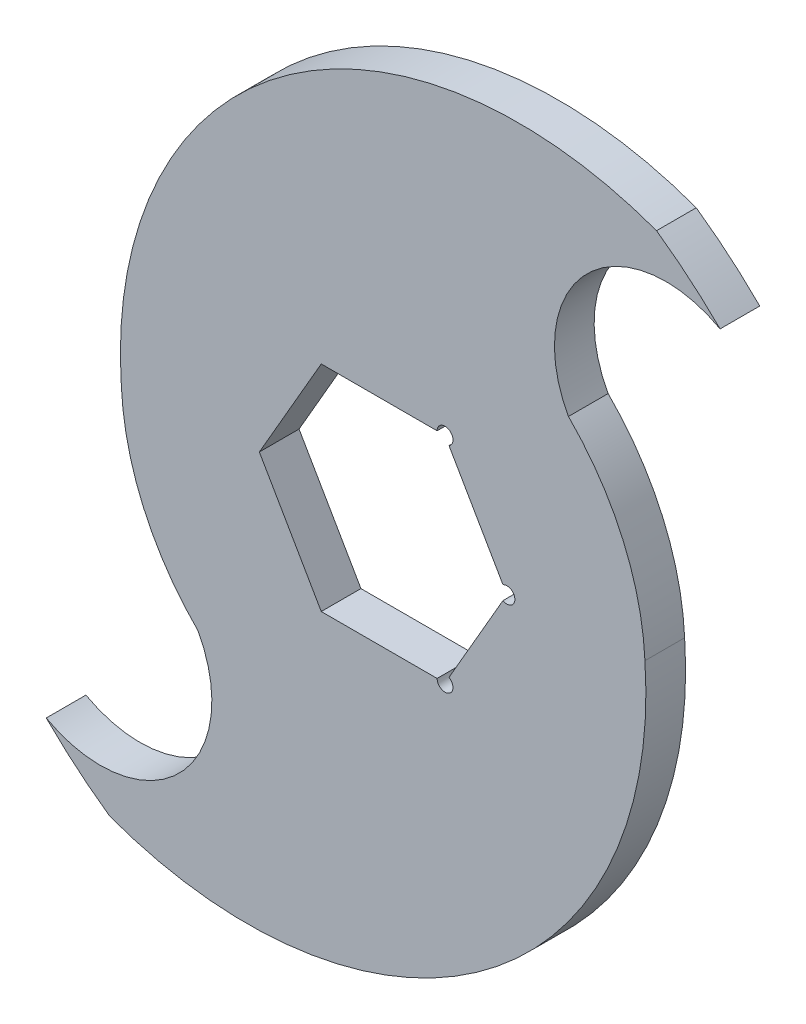
from build123d import *

# Parameters (mm, degrees)
BOSS_EXTRUDE1_DEPTH = 2.5


with BuildPart() as part:
    # Model → Boss-Extrude1 (new, symmetric)
    with BuildSketch(Plane.XY):
        with BuildLine():
            ThreePointArc((807.400029607, 115.214424851), (759.927821467, 108.213195948), (740.008452339, 64.557194238))
            ThreePointArc((740.008452339, 64.557194238), (742.783849766, 52.747710067), (749.639069353, 42.739078209))
            ThreePointArc((749.639069353, 42.739078209), (747.292156458, 25.994108012), (730.547186261, 23.647195117))
            ThreePointArc((730.547186261, 23.647195117), (734.400795358, 20.115585583), (738.547156658, 16.932779125))
            ThreePointArc((738.547156658, 16.932779125), (786.019364798, 23.934008028), (805.938733926, 67.590009739))
            ThreePointArc((805.938733926, 67.590009739), (803.163336499, 79.399493909), (796.308116912, 89.408125767))
            ThreePointArc((796.308116912, 89.408125767), (798.655029807, 106.153095964), (815.400000004, 108.500008859))
            ThreePointArc((815.400000004, 108.500008859), (811.546390907, 112.031618393), (807.400029607, 115.214424851))
        make_face()
        with BuildLine():
            Line((788.062050401, 66.939627392), (781.267821767, 78.707576584))
            ThreePointArc((781.267821767, 78.707576584), (781.267821767, 80.439627392), (779.767821767, 79.573601988))
            Line((779.767821767, 79.573601988), (765.179364498, 79.573601988))
            Line((765.179364498, 79.573601988), (757.385135864, 66.073601988))
            Line((757.385135864, 66.073601988), (765.179364498, 52.573601988))
            Line((765.179364498, 52.573601988), (779.767821767, 52.573601988))
            ThreePointArc((779.767821767, 52.573601988), (781.267821767, 51.707576584), (781.267821767, 53.439627392))
            Line((781.267821767, 53.439627392), (788.062050401, 65.207576584))
            ThreePointArc((788.062050401, 65.207576584), (789.562050401, 66.073601988), (788.062050401, 66.939627392))
        make_face(mode=Mode.SUBTRACT)
    extrude(amount=BOSS_EXTRUDE1_DEPTH, both=True)


solid = part.part
